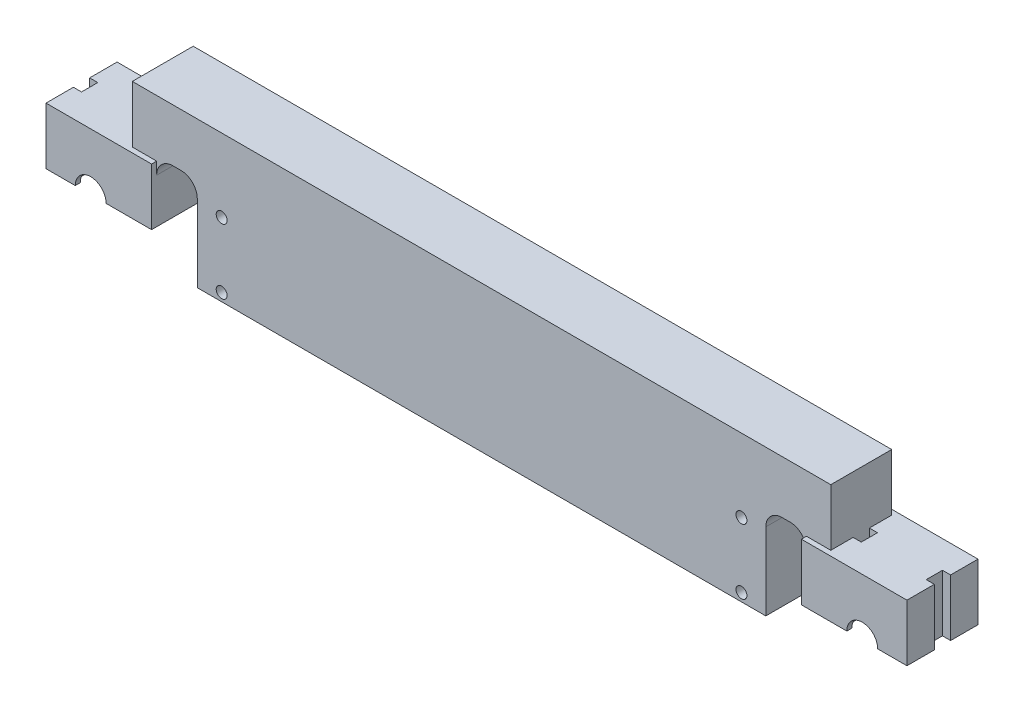
from build123d import *

# Parameters (mm, degrees)
BOSS_EXTRUDE1_DEPTH      = 9.525
BOSS_EXTRUDE1_DEPTH_BACK = 9.525
SKETCH1_R                = 1.7
SKETCH2_W                = 2.54
SKETCH2_H                = 5.08
CUT_EXTRUDE1_DEPTH       = 27.686
BOSS_EXTRUDE2_DEPTH      = 1.5875


with BuildPart() as part:
    # Sketch1 → Boss-Extrude1 (new, two sides: drawn at the far end of the back side and taken through both)
    with BuildSketch(Plane.XY.offset(-BOSS_EXTRUDE1_DEPTH_BACK)):
        with BuildLine():
            Line((-109.22, 0), (-134.62, 0))
            Line((-134.62, 0), (-134.62, -17.78))
            Line((-134.62, -17.78), (-127, -17.78))
            ThreePointArc((-127, -17.78), (-120.65, -11.43), (-114.3, -17.78))
            Line((-114.3, -17.78), (-109.22, -17.78))
            Line((-109.22, -17.78), (-101.6, -17.78))
            Line((-101.6, -17.78), (-101.6, -3.81))
            ThreePointArc((-101.6, -3.81), (-100.112102448, -0.217897552), (-96.52, 1.27))
            Line((-96.52, 1.27), (-93.98, 1.27))
            ThreePointArc((-93.98, 1.27), (-90.387897552, -0.217897552), (-88.9, -3.81))
            Line((-88.9, -3.81), (-88.9, -17.78))
            Line((-88.9, -17.78), (-88.9, -27.94))
            Line((-88.9, -27.94), (88.9, -27.94))
            Line((88.9, -27.94), (88.9, -17.78))
            Line((88.9, -17.78), (88.9, -3.81))
            ThreePointArc((88.9, -3.81), (90.387897552, -0.217897552), (93.98, 1.27))
            Line((93.98, 1.27), (96.52, 1.27))
            ThreePointArc((96.52, 1.27), (100.112102448, -0.217897552), (101.6, -3.81))
            Line((101.6, -3.81), (101.6, -17.78))
            Line((101.6, -17.78), (109.22, -17.78))
            Line((109.22, -17.78), (114.3, -17.78))
            ThreePointArc((114.3, -17.78), (120.65, -11.43), (127, -17.78))
            Line((127, -17.78), (134.62, -17.78))
            Line((134.62, -17.78), (134.62, 0))
            Line((134.62, 0), (109.22, 0))
            Line((109.22, 0), (109.22, 17.78))
            Line((109.22, 17.78), (-109.22, 17.78))
            Line((-109.22, 17.78), (-109.22, 0))
        make_face()
        with Locations((-81.28, -25.4)):
            Circle(SKETCH1_R, mode=Mode.SUBTRACT)
        with Locations((-81.28, -5.08)):
            Circle(SKETCH1_R, mode=Mode.SUBTRACT)
        with Locations((81.28, -25.4)):
            Circle(SKETCH1_R, mode=Mode.SUBTRACT)
        with Locations((81.28, -5.08)):
            Circle(SKETCH1_R, mode=Mode.SUBTRACT)
    extrude(amount=BOSS_EXTRUDE1_DEPTH + BOSS_EXTRUDE1_DEPTH_BACK)

    # Sketch2 → Cut-Extrude1 (cut)
    with BuildSketch(Plane(origin=(0, 0, 0), x_dir=(1, 0, 0), z_dir=(0, 1, 0))):
        with Locations((-110.49, 0)):
            Rectangle(SKETCH2_W, SKETCH2_H)
        with Locations((-133.35, 0)):
            Rectangle(SKETCH2_W, SKETCH2_H)
        with Locations((133.35, 0)):
            Rectangle(SKETCH2_W, SKETCH2_H)
        with Locations((110.49, 0)):
            Rectangle(SKETCH2_W, SKETCH2_H)
    extrude(amount=-CUT_EXTRUDE1_DEPTH, mode=Mode.SUBTRACT)

    # Sketch3 → Boss-Extrude2 (add)
    with BuildSketch(Plane.XY.offset(9.525)):
        with BuildLine():
            Line((-134.62, 0), (-101.6, 0))
            Line((-101.6, 0), (-101.6, -17.78))
            Line((-101.6, -17.78), (-115.824, -17.78))
            ThreePointArc((-115.824, -17.78), (-120.65, -12.954), (-125.476, -17.78))
            Line((-125.476, -17.78), (-134.62, -17.78))
            Line((-134.62, -17.78), (-134.62, 0))
        make_face()
        with BuildLine():
            Line((134.62, -17.78), (125.476, -17.78))
            ThreePointArc((125.476, -17.78), (120.65, -12.954), (115.824, -17.78))
            Line((115.824, -17.78), (101.6, -17.78))
            Line((101.6, -17.78), (101.6, 0))
            Line((101.6, 0), (134.62, 0))
            Line((134.62, 0), (134.62, -17.78))
        make_face()
    boss_extrude2 = extrude(amount=BOSS_EXTRUDE2_DEPTH)

    # Mirror1: Boss-Extrude2 across plane
    add(boss_extrude2.mirror(Plane.XY))


solid = part.part
